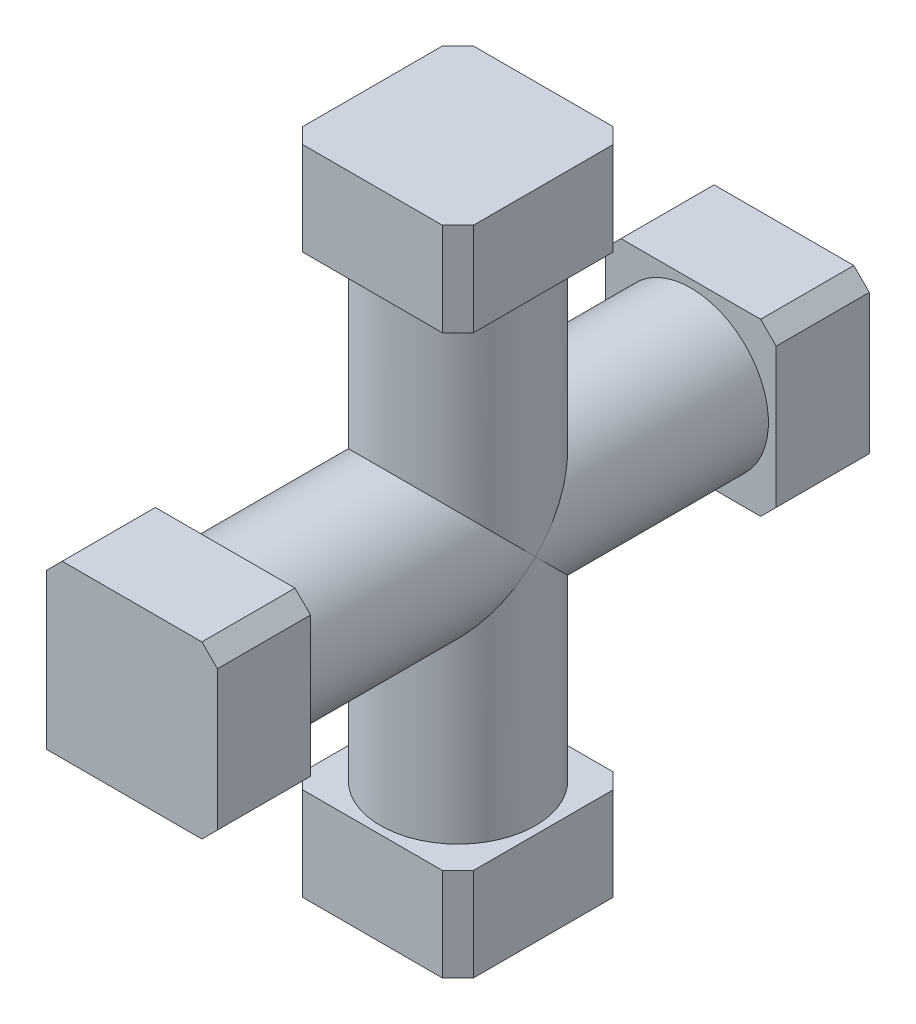
from build123d import *

# Parameters (mm, degrees)
SKETCH1_R                = 2.5
BOSS_EXTRUDE1_DEPTH      = 15
SKETCH3_R                = 2.5
BOSS_EXTRUDE2_DEPTH      = 7.5
SKETCH4_W                = 5.5
SKETCH4_H                = 5.5
BOSS_EXTRUDE3_DEPTH      = 3
CHAMFER1_SIZE            = 0.5
CHAMFER2_SIZE            = 0.5
CHAMFER3_SIZE            = 0.5
CHAMFER1_OF_MIRROR1_SIZE = 0.5
CHAMFER2_OF_MIRROR1_SIZE = 0.5
SKETCH5_W                = 5.5
SKETCH5_H                = 5.5
BOSS_EXTRUDE4_DEPTH      = 3
CHAMFER4_SIZE            = 0.5
CHAMFER5_SIZE            = 0.5
CHAMFER4_OF_MIRROR2_SIZE = 0.5
CHAMFER5_OF_MIRROR2_SIZE = 0.5


with BuildPart() as part:
    # Sketch1 → Boss-Extrude1 (new body)
    with BuildSketch(Plane.XY):
        Circle(SKETCH1_R)
    extrude(amount=BOSS_EXTRUDE1_DEPTH)

    # Sketch3 → Boss-Extrude2 (add, symmetric)
    with BuildSketch(Plane(origin=(0, 0, 0), x_dir=(1, 0, 0), z_dir=(0, 1, 0))):
        with Locations((0, -7.5)):
            Circle(SKETCH3_R)
    extrude(amount=BOSS_EXTRUDE2_DEPTH, both=True)

    # Sketch4 → Boss-Extrude3 (add)
    with BuildSketch(Plane(origin=(0, 0, 0), x_dir=(-1, 0, 0), z_dir=(0, 0, -1))):
        Rectangle(SKETCH4_W, SKETCH4_H)
    boss_extrude3 = extrude(amount=BOSS_EXTRUDE3_DEPTH)

    # Chamfer1
    chamfer1_edges = [part.edges().sort_by_distance(p)[0] for p in [
        (-2.75, 2.75, -1.5),
    ]]
    chamfer(chamfer1_edges, length=CHAMFER1_SIZE)

    # Chamfer2
    chamfer2_edges = [part.edges().sort_by_distance(p)[0] for p in [
        (2.75, 2.75, -1.5),
        (2.75, -2.75, -1.5),
    ]]
    chamfer(chamfer2_edges, length=CHAMFER2_SIZE)

    # Chamfer3
    chamfer3_edges = [part.edges().sort_by_distance(p)[0] for p in [
        (-2.75, -2.75, -1.5),
    ]]
    chamfer(chamfer3_edges, length=CHAMFER3_SIZE)

    # Mirror1: Boss-Extrude3 across plane
    add(boss_extrude3.mirror(Plane(origin=(0, 0, 7.5), x_dir=(1, 0, 0), z_dir=(0, 0, -1))))

    # Chamfer1 of Mirror1
    chamfer1_of_mirror1_edges = [part.edges().sort_by_distance(p)[0] for p in [
        (-2.75, 2.75, 16.5),
    ]]
    chamfer(chamfer1_of_mirror1_edges, length=CHAMFER1_OF_MIRROR1_SIZE)

    # Chamfer2 of Mirror1
    chamfer2_of_mirror1_edges = [part.edges().sort_by_distance(p)[0] for p in [
        (2.75, 2.75, 16.5),
        (2.75, -2.75, 16.5),
    ]]
    chamfer(chamfer2_of_mirror1_edges, length=CHAMFER2_OF_MIRROR1_SIZE)

    # Sketch5 → Boss-Extrude4 (add)
    with BuildSketch(Plane(origin=(0, 7.5, 0), x_dir=(1, 0, 0), z_dir=(0, 1, 0))):
        with Locations((0, -7.502861602)):
            Rectangle(SKETCH5_W, SKETCH5_H)
    boss_extrude4 = extrude(amount=BOSS_EXTRUDE4_DEPTH)

    # Chamfer4
    chamfer4_edges = [part.edges().sort_by_distance(p)[0] for p in [
        (-2.75, 9, 4.752861602),
        (-2.75, 9, 10.252861602),
        (2.75, 9, 4.752861602),
    ]]
    chamfer(chamfer4_edges, length=CHAMFER4_SIZE)

    # Chamfer5
    chamfer5_edges = [part.edges().sort_by_distance(p)[0] for p in [
        (2.75, 9, 10.252861602),
    ]]
    chamfer(chamfer5_edges, length=CHAMFER5_SIZE)

    # Mirror2: Boss-Extrude4 across plane
    add(boss_extrude4.mirror(Plane(origin=(0, 0, 0), x_dir=(0, 0, 1), z_dir=(0, -1, 0))))

    # Chamfer4 of Mirror2
    chamfer4_of_mirror2_edges = [part.edges().sort_by_distance(p)[0] for p in [
        (-2.75, -9, 4.752861602),
        (-2.75, -9, 10.252861602),
        (2.75, -9, 4.752861602),
    ]]
    chamfer(chamfer4_of_mirror2_edges, length=CHAMFER4_OF_MIRROR2_SIZE)

    # Chamfer5 of Mirror2
    chamfer5_of_mirror2_edges = [part.edges().sort_by_distance(p)[0] for p in [
        (2.75, -9, 10.252861602),
    ]]
    chamfer(chamfer5_of_mirror2_edges, length=CHAMFER5_OF_MIRROR2_SIZE)


solid = part.part
